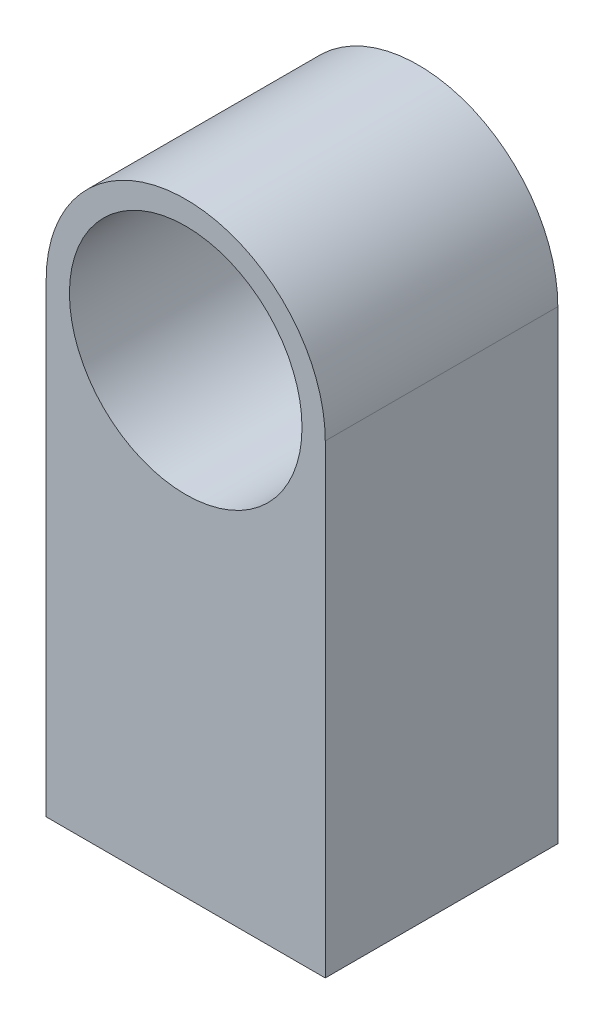
from build123d import *

# Parameters (mm, degrees)
SKETCH_1_R          = 50
EXTRUDE_1_DEPTH     = 100
SKETCH_2_R          = 6.693038614
CUT_EXTRUDE_1_DEPTH = 5


with BuildPart() as part:
    # 草图1 → 凸台-拉伸1 (new body)
    with BuildSketch(Plane.XY):
        with BuildLine():
            Line((-51.262135922, 98.058252427), (-51.262135922, -101.941747573))
            Line((-51.262135922, -101.941747573), (68.737864078, -101.941747573))
            Line((68.737864078, -101.941747573), (68.737864078, 98.058252427))
            ThreePointArc((68.737864078, 98.058252427), (8.737864078, 158.058252427), (-51.262135922, 98.058252427))
        make_face()
        with Locations((8.737864078, 98.058252427)):
            Circle(SKETCH_1_R, mode=Mode.SUBTRACT)
    extrude(amount=EXTRUDE_1_DEPTH)

    # 草图2 → 切除-拉伸1 (cut)
    with BuildSketch(Plane(origin=(0, -101.941747573, 0), x_dir=(-1, 0, 0), z_dir=(0, -1, 0))):
        with Locations(Location((-8.737864078, -52.248339219, 0), (0, 0, 90))):
            Circle(SKETCH_2_R)
    extrude(amount=-CUT_EXTRUDE_1_DEPTH, mode=Mode.SUBTRACT)


solid = part.part
